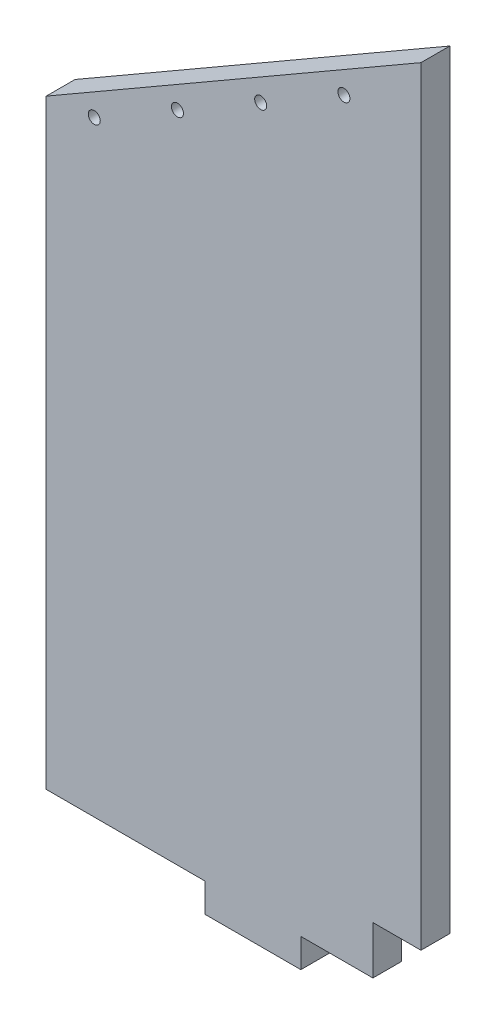
from build123d import *

# Parameters (mm, degrees)
BOSS_EXTRU_1_DEPTH      = 6
ESQUISSE2_R             = 1.25
ESQUISSE2_W             = 10
ESQUISSE2_H             = 10
ENL_V_MAT_EXTRU_1_DEPTH = 10
ESQUISSE4_W             = 20
ESQUISSE4_H             = 6
BOSS_EXTRU_2_DEPTH      = 6


with BuildPart() as part:
    # Esquisse1 → Boss.-Extru.1 (new body)
    with BuildSketch(Plane.XY):
        Polygon((-78, 0), (-78, 124.966679003), (0, 170), (0, 0), align=None)
    extrude(amount=BOSS_EXTRU_1_DEPTH)

    # Esquisse2 → Enlèv. mat.-Extru.1 (cut)
    with BuildSketch(Plane.XY.offset(6)):
        with Locations((-68, 126.121379542)):
            Circle(ESQUISSE2_R)
        with Locations((-50.679491924, 136.121379542)):
            Circle(ESQUISSE2_R)
        with Locations((-16.038475773, 156.121379542)):
            Circle(ESQUISSE2_R)
        with Locations((-33.358983849, 146.121379542)):
            Circle(ESQUISSE2_R)
        with Locations((-5, 5)):
            Rectangle(ESQUISSE2_W, ESQUISSE2_H)
    extrude(amount=-ENL_V_MAT_EXTRU_1_DEPTH, mode=Mode.SUBTRACT)

    # Esquisse4 → Boss.-Extru.2 (add)
    with BuildSketch(Plane.XZ):
        with Locations((-35, 3)):
            Rectangle(ESQUISSE4_W, ESQUISSE4_H)
    extrude(amount=BOSS_EXTRU_2_DEPTH)


solid = part.part
